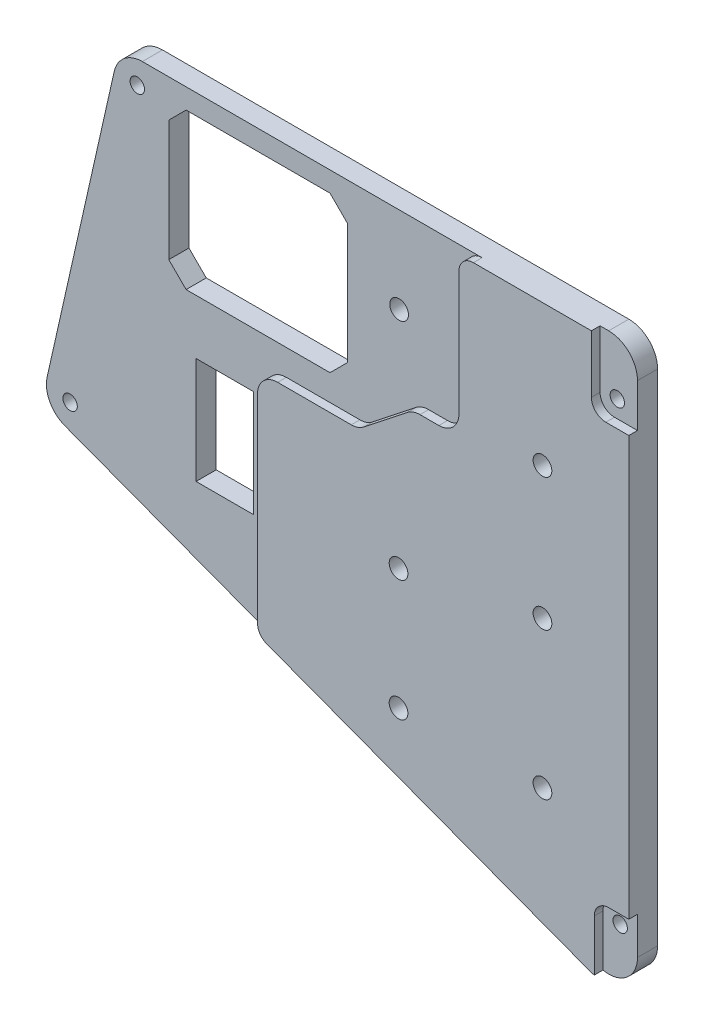
from build123d import *

# Parameters (mm, degrees)
BOSS_EXTRUDE1_DEPTH = 10
SKETCH2_R           = 3.25
SKETCH2_W           = 20
SKETCH2_H           = 37
CUT_EXTRUDE1_DEPTH  = 10
CUT_EXTRUDE2_START  = -3
SKETCH3_W           = 20
SKETCH3_H           = 37
SKETCH3_R           = 3.25
CUT_EXTRUDE2_DEPTH  = 3
FILLET1_R           = 5
CUT_EXTRUDE3_DEPTH  = 3
SKETCH5_R           = 2.5
CUT_EXTRUDE4_DEPTH  = 7


with BuildPart() as part:
    # Sketch1 → Boss-Extrude1 (new body)
    with BuildSketch(Plane.XY):
        with BuildLine():
            Line((-72.324772809, -75.56835732), (113.0098159, -145.404579152))
            ThreePointArc((113.0098159, -145.404579152), (122.225331612, -144.27064673), (126.535908242, -136.046872553))
            Line((126.535908242, -136.046872553), (126.535908242, 37.498632429))
            ThreePointArc((126.535908242, 37.498632429), (123.606976053, 44.569700241), (116.535908242, 47.498632429))
            Line((116.535908242, 47.498632429), (-45.464091758, 47.498632429))
            ThreePointArc((-45.464091758, 47.498632429), (-51.711042234, 45.307320523), (-55.220189319, 39.69375438))
            Line((-55.220189319, 39.69375438), (-78.554778028, -64.01552877))
            ThreePointArc((-78.554778028, -64.01552877), (-77.600447564, -70.957112136), (-72.324772809, -75.56835732))
        make_face()
    extrude(amount=BOSS_EXTRUDE1_DEPTH)

    # Sketch2 → Cut-Extrude1 (cut)
    with BuildSketch(Plane.XY.offset(10)):
        with Locations((43.734834886, 17.498632429)):
            Circle(SKETCH2_R)
        with Locations((96.535908242, -1.501367571)):
            Circle(SKETCH2_R)
        with Locations((96.535908242, -47.501367571)):
            Circle(SKETCH2_R)
        with Locations((96.535908242, -98.501367571)):
            Circle(SKETCH2_R)
        with Locations((46.535908242, -57.501367571)):
            Circle(SKETCH2_R)
        with Locations((46.535908242, -99.501367571)):
            Circle(SKETCH2_R)
        with Locations((-16.798680467, -51.001367571)):
            Rectangle(SKETCH2_W, SKETCH2_H)
        Polygon((-30.265165114, 40.498632429), (19.734834886, 40.498632429), (25.734834886, 34.498632429), (25.734834886, -7.501367571), (19.734834886, -13.501367571), (-30.265165114, -13.501367571), (-36.265165114, -7.501367571), (-36.265165114, 34.498632429), align=None)
    extrude(amount=-CUT_EXTRUDE1_DEPTH, mode=Mode.SUBTRACT)

    # Sketch3 → Cut-Extrude2 (cut)
    with BuildSketch(Plane.XY.offset(10).offset(CUT_EXTRUDE2_START)):
        with BuildLine():
            Line((-72.324772809, -75.56835732), (-2.464091758, -101.892671919))
            Line((-2.464091758, -101.892671919), (-2.464091758, -29.501367571))
            ThreePointArc((-2.464091758, -29.501367571), (-0.413839227, -24.551620103), (4.535908242, -22.501367571))
            Line((4.535908242, -22.501367571), (30.105771034, -22.501367571))
            ThreePointArc((30.105771034, -22.501367571), (32.401500165, -22.114205672), (34.443281054, -20.99554693))
            Line((34.443281054, -20.99554693), (49.628535429, -9.007188212))
            ThreePointArc((49.628535429, -9.007188212), (51.670316318, -7.88852947), (53.966045449, -7.501367571))
            Line((53.966045449, -7.501367571), (60.535908242, -7.501367571))
            ThreePointArc((60.535908242, -7.501367571), (65.48565571, -5.451115039), (67.535908242, -0.501367571))
            Line((67.535908242, -0.501367571), (67.535908242, 47.498632429))
            Line((67.535908242, 47.498632429), (-45.464091733, 47.498632429))
            ThreePointArc((-45.464091733, 47.498632429), (-51.710766684, 45.307540935), (-55.220034365, 39.69444284))
            Line((-55.220034365, 39.69444284), (-55.220189319, 39.69375438))
            Line((-55.220189319, 39.69375438), (-78.554778028, -64.01552877))
            ThreePointArc((-78.554778028, -64.01552877), (-77.600447564, -70.957112136), (-72.324772809, -75.56835732))
        make_face()
        with Locations((-16.798680467, -51.001367571)):
            Rectangle(SKETCH3_W, SKETCH3_H, mode=Mode.SUBTRACT)
        Polygon((-30.265165114, -13.501367571), (-36.265165114, -7.501367571), (-36.265165114, 34.498632429), (-30.265165114, 40.498632429), (19.734834886, 40.498632429), (25.734834886, 34.498632429), (25.734834886, -7.501367571), (19.734834886, -13.501367571), align=None, mode=Mode.SUBTRACT)
        with Locations((43.734834886, 17.498632429)):
            Circle(SKETCH3_R, mode=Mode.SUBTRACT)
    extrude(amount=CUT_EXTRUDE2_DEPTH, mode=Mode.SUBTRACT)

    # Fillet1
    fillet1_edges = [part.edges().sort_by_distance(p)[0] for p in [
        (-2.464091758, -101.892671919, 8.5),
        (67.535908242, 47.498632429, 8.5),
    ]]
    fillet(fillet1_edges, radius=FILLET1_R)

    # Sketch4 → Cut-Extrude3 (cut)
    with BuildSketch(Plane.XY.offset(10)):
        with BuildLine():
            Line((126.535908242, 22.498632429), (118.535908242, 22.498632429))
            ThreePointArc((118.535908242, 22.498632429), (115.000374336, 23.963098523), (113.535908242, 27.498632429))
            Line((113.535908242, 27.498632429), (113.535908242, 47.498632429))
            Line((113.535908242, 47.498632429), (126.535908242, 47.498632429))
            Line((126.535908242, 47.498632429), (126.535908242, 22.498632429))
        make_face()
        with BuildLine():
            Line((126.535908242, -123.046872553), (119.535908242, -123.046872553))
            ThreePointArc((119.535908242, -123.046872553), (116.000374336, -124.511338647), (114.535908242, -128.046872553))
            Line((114.535908242, -128.046872553), (114.535908242, -146.046872553))
            Line((114.535908242, -146.046872553), (126.535908242, -146.046872553))
            Line((126.535908242, -146.046872553), (126.535908242, -123.046872553))
        make_face()
    extrude(amount=-CUT_EXTRUDE3_DEPTH, mode=Mode.SUBTRACT)

    # Sketch5 → Cut-Extrude4 (cut)
    with BuildSketch(Plane.XY.offset(7)):
        with Locations((120.535908242, -129.046872553)):
            Circle(SKETCH5_R)
        with Locations((119.535908242, 28.498632429)):
            Circle(SKETCH5_R)
        with Locations((-47.220189319, 39.498632429)):
            Circle(SKETCH5_R)
        with Locations((-70.554778028, -67.56835732)):
            Circle(SKETCH5_R)
    extrude(amount=-CUT_EXTRUDE4_DEPTH, mode=Mode.SUBTRACT)


solid = part.part
